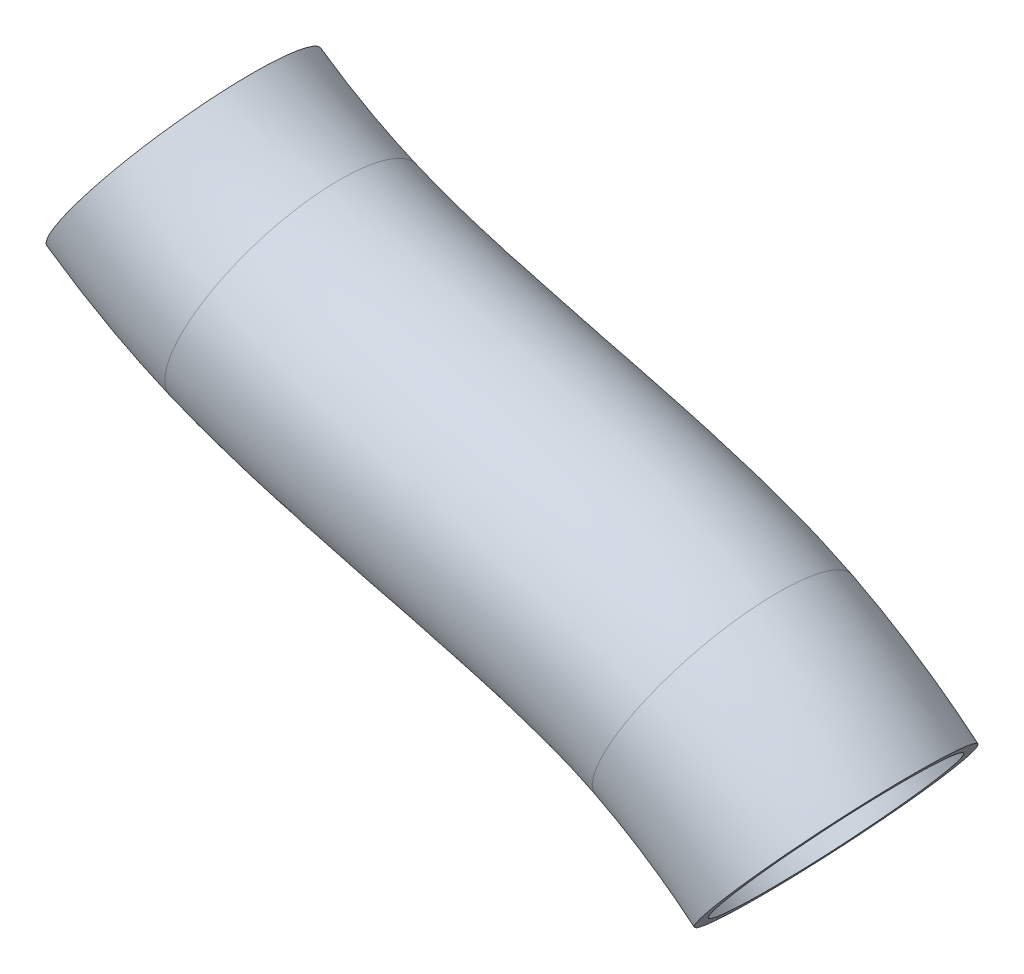
from build123d import *

# Parameters (mm, degrees)
SKETCH_2_R   = 10
SKETCH_2_R_2 = 9


with BuildPart() as part:
    # 扫描1: sweep along a path in 草图1
    with BuildLine() as sweep_1_path:  # in the path sketch's own coordinates; laid on its plane below (add() does not lay a ready-made edge on the line's plane)
        ThreePointArc((63.141814145, 40.490666647), (58.599282927, 43.882735594), (53.701958648, 46.7387707))
        add(Edge.make_bspline(
            [(53.701958648, 46.7387707), (48.603839303, 49.336392251), (35.429712495, 52.699485328), (22.337212866, 56.068517029), (17.670736666, 58.049318656)],
            knots=[0, 0, 0, 0, 0.529673669, 1, 1, 1, 1], degree=3))
        ThreePointArc((17.670736666, 58.049318656), (12.966812078, 60.343575972), (8.528471273, 63.116959114))
    # 草图2 → 扫描1 (sweep)
    with BuildSketch(Plane(origin=(8.528471273, 63.116959114, 0), x_dir=(0, 0, -1), z_dir=(0.819152044288993, -0.5735764363510444, 0))):
        Circle(SKETCH_2_R)
        Circle(SKETCH_2_R_2, mode=Mode.SUBTRACT)
    sweep(path=Plane.XY * sweep_1_path.line)


solid = part.part
